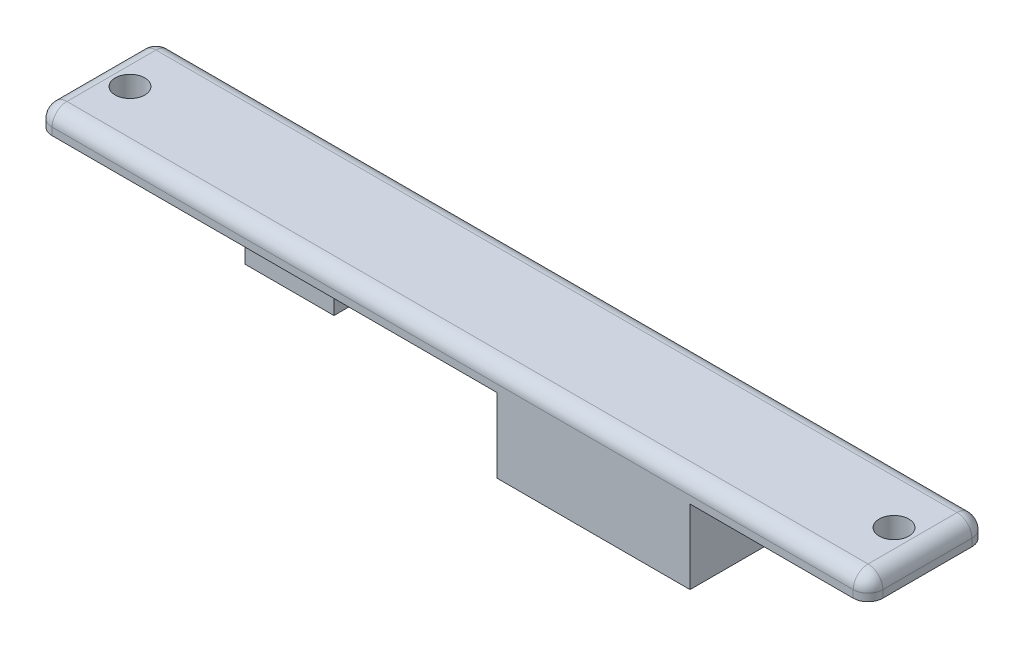
from build123d import *

# Parameters (mm, degrees)
SKETCH1_W               = 56
SKETCH1_H               = 8
BOSS_EXTRUDE1_DEPTH     = 1.5
CUT_EXTRUDE1_DEPTH      = 29.324018077
CUT_EXTRUDE1_DEPTH_BACK = 29.324018077
SKETCH2_R               = 1
FILLET1_R               = 1
SKETCH3_W               = 13
SKETCH3_H               = 8
SKETCH3_W_2             = 6
SKETCH3_H_2             = 4
BOSS_EXTRUDE2_DEPTH     = 5


with BuildPart() as part:
    # Sketch1 → Boss-Extrude1 (new body)
    with BuildSketch(Plane(origin=(0, 0, 0), x_dir=(1, 0, 0), z_dir=(0, 1, 0))):
        Rectangle(SKETCH1_W, SKETCH1_H)
    extrude(amount=BOSS_EXTRUDE1_DEPTH)

    # Sketch2 → Cut-Extrude1 (cut, two sides: drawn at the far end of the back side and taken through both)
    with BuildSketch(Plane(origin=(0, 1.5, 0), x_dir=(1, 0, 0), z_dir=(0, 1, 0)).offset(-CUT_EXTRUDE1_DEPTH_BACK)):
        with Locations(Location((-25.75, 0, 0), (0, 0, 270))):
            Circle(SKETCH2_R)
        with Locations(Location((25.75, 0, 0), (0, 0, 270))):
            Circle(SKETCH2_R)
    extrude(amount=CUT_EXTRUDE1_DEPTH + CUT_EXTRUDE1_DEPTH_BACK, mode=Mode.SUBTRACT)

    # Fillet1
    fillet1_edges = [part.edges().sort_by_distance(p)[0] for p in [
        (28, 1.5, 0),
        (0, 1.5, -4),
        (-28, 1.5, 0),
        (-28, 0.75, -4),
        (28, 0.75, -4),
        (28, 0.75, 4),
        (-28, 0.75, 4),
        (0, 1.5, 4),
    ]]
    fillet(fillet1_edges, radius=FILLET1_R)

    # Sketch3 → Boss-Extrude2 (add)
    with BuildSketch(Plane.XZ):
        with Locations((9.5, 0)):
            Rectangle(SKETCH3_W, SKETCH3_H)
        with Locations((-15, -2)):
            Rectangle(SKETCH3_W_2, SKETCH3_H_2)
    extrude(amount=BOSS_EXTRUDE2_DEPTH)


solid = part.part
